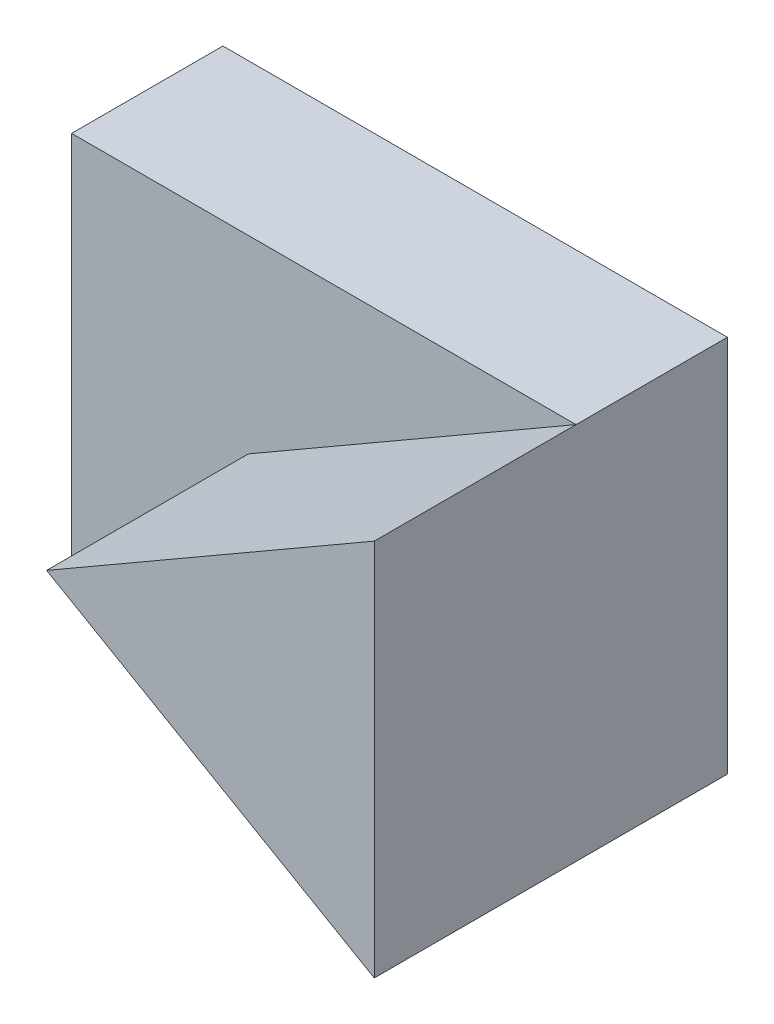
from build123d import *

# Parameters (mm, degrees)
SKETCH_1_W      = 20
SKETCH_1_H      = 15
EXTRUDE_1_DEPTH = 3
EXTRUDE_2_DEPTH = 8
EXTRUDE_3_DEPTH = 1


with BuildPart() as part:
    # 草图1 → 凸台-拉伸1 (new, symmetric)
    with BuildSketch(Plane.XY):
        with Locations((-7.014925373, 7.5)):
            Rectangle(SKETCH_1_W, SKETCH_1_H)
    extrude(amount=EXTRUDE_1_DEPTH, both=True)



with BuildPart() as body_2:
    # 草图2 → 凸台-拉伸2 (new body)
    with BuildSketch(Plane.XY.offset(3)):
        Polygon((2.985074627, 0), (2.985074627, 15), (-10.00530643, 7.5), align=None)
    extrude(amount=EXTRUDE_2_DEPTH)


with BuildPart() as part_1:
    add(part.part)

    add(body_2.part)  # 凸台-拉伸3 merges body 2
    # Sketch 3D_1 → 凸台-拉伸3 (add, along a direction that is not the sketch's normal)
    with BuildSketch(Plane(origin=(-3.510115902, 3.75, 11), x_dir=(-0.368730866446014, -0.3945266526955367, -0.8416568590838117), z_dir=(0.7305877107722233, -0.6828188609496683, 0))):
        Polygon((0, 0), (9.505061253, 0), (6.733254873, 4.320101714), align=None)
    extrude(amount=-EXTRUDE_3_DEPTH, dir=(0.8660254037844387, -0.49999999999999983, 0))


solid = part_1.part
